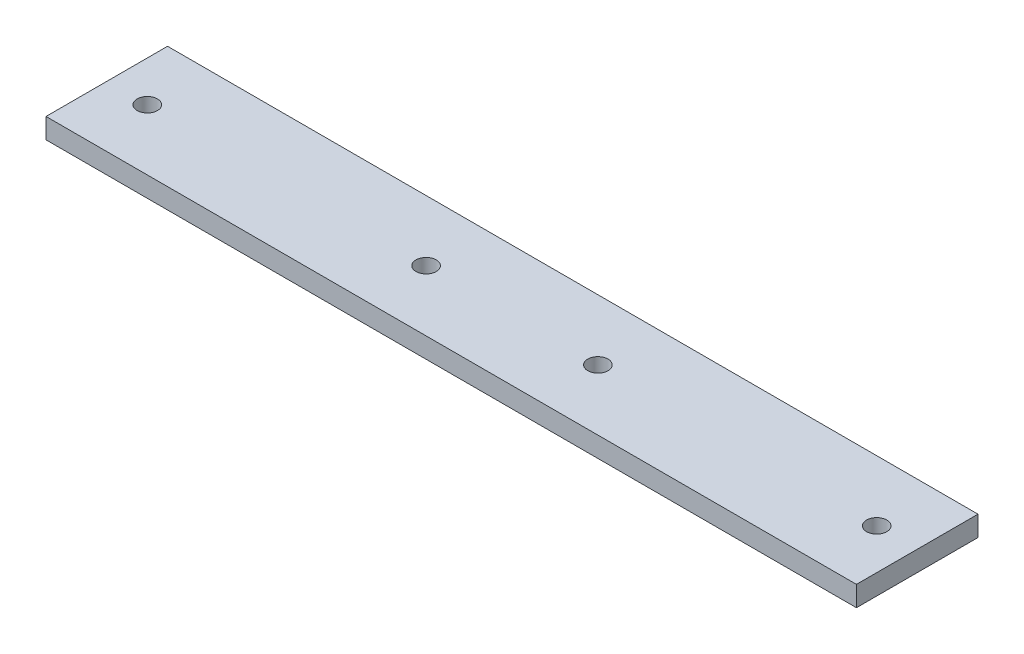
from build123d import *

# Parameters (mm, degrees)
SKETCH1_W           = 200
SKETCH1_H           = 30
SKETCH1_R           = 2.5
BOSS_EXTRUDE1_DEPTH = 5


with BuildPart() as part:
    # Sketch1 → Boss-Extrude1 (new body)
    with BuildSketch(Plane(origin=(0, 0, 0), x_dir=(1, 0, 0), z_dir=(0, 1, 0))):
        with Locations((86, -7.916666667)):
            Rectangle(SKETCH1_W, SKETCH1_H)
        with Locations(Location((176, -7.916666667, 0), (0, 0, 270))):
            Circle(SKETCH1_R, mode=Mode.SUBTRACT)
        with Locations(Location((-4, -7.916666667, 0), (0, 0, 90))):
            Circle(SKETCH1_R, mode=Mode.SUBTRACT)
        with Locations(Location((107.2, -7.916666667, 0), (0, 0, 270))):
            Circle(SKETCH1_R, mode=Mode.SUBTRACT)
        with Locations(Location((64.8, -7.916666667, 0), (0, 0, 90))):
            Circle(SKETCH1_R, mode=Mode.SUBTRACT)
    extrude(amount=BOSS_EXTRUDE1_DEPTH)


solid = part.part
